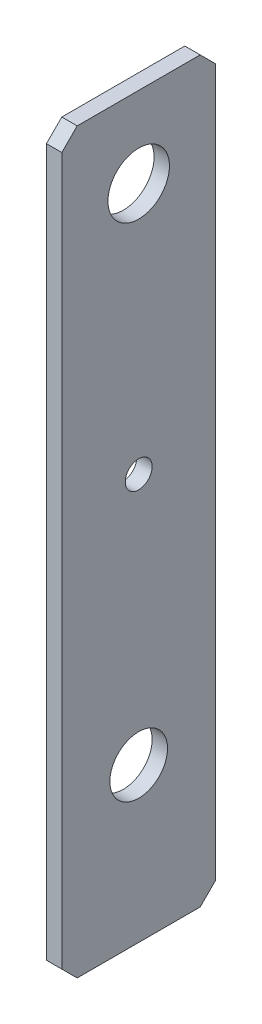
from build123d import *

# Parameters (mm, degrees)
SKETCH1_W           = 20
SKETCH1_H           = 96
BOSS_EXTRUDE1_DEPTH = 2
SKETCH2_R           = 4
SKETCH2_R_2         = 1.75
SKETCH2_R_3         = 3.75
CUT_EXTRUDE1_DEPTH  = 2
CHAMFER1_SIZE       = 2


with BuildPart() as part:
    # Sketch1 → Boss-Extrude1 (new body)
    with BuildSketch(Plane(origin=(0, 0, 0), x_dir=(0, 0, -1), z_dir=(1, 0, 0))):
        with Locations((10, 48)):
            Rectangle(SKETCH1_W, SKETCH1_H)
    extrude(amount=BOSS_EXTRUDE1_DEPTH)

    # Sketch2 → Cut-Extrude1 (cut)
    with BuildSketch(Plane(origin=(2, 0, 0), x_dir=(0, 0, -1), z_dir=(1, 0, 0))):
        with Locations((10, 85.5)):
            Circle(SKETCH2_R)
        with Locations((10, 52.75)):
            Circle(SKETCH2_R_2)
        with Locations((10, 20)):
            Circle(SKETCH2_R_3)
    extrude(amount=-CUT_EXTRUDE1_DEPTH, mode=Mode.SUBTRACT)

    # Chamfer1
    chamfer1_edges = [part.edges().sort_by_distance(p)[0] for p in [
        (1, 96, 0),
        (1, 96, -20),
        (1, 0, -20),
        (1, 0, 0),
    ]]
    chamfer(chamfer1_edges, length=CHAMFER1_SIZE)


solid = part.part
